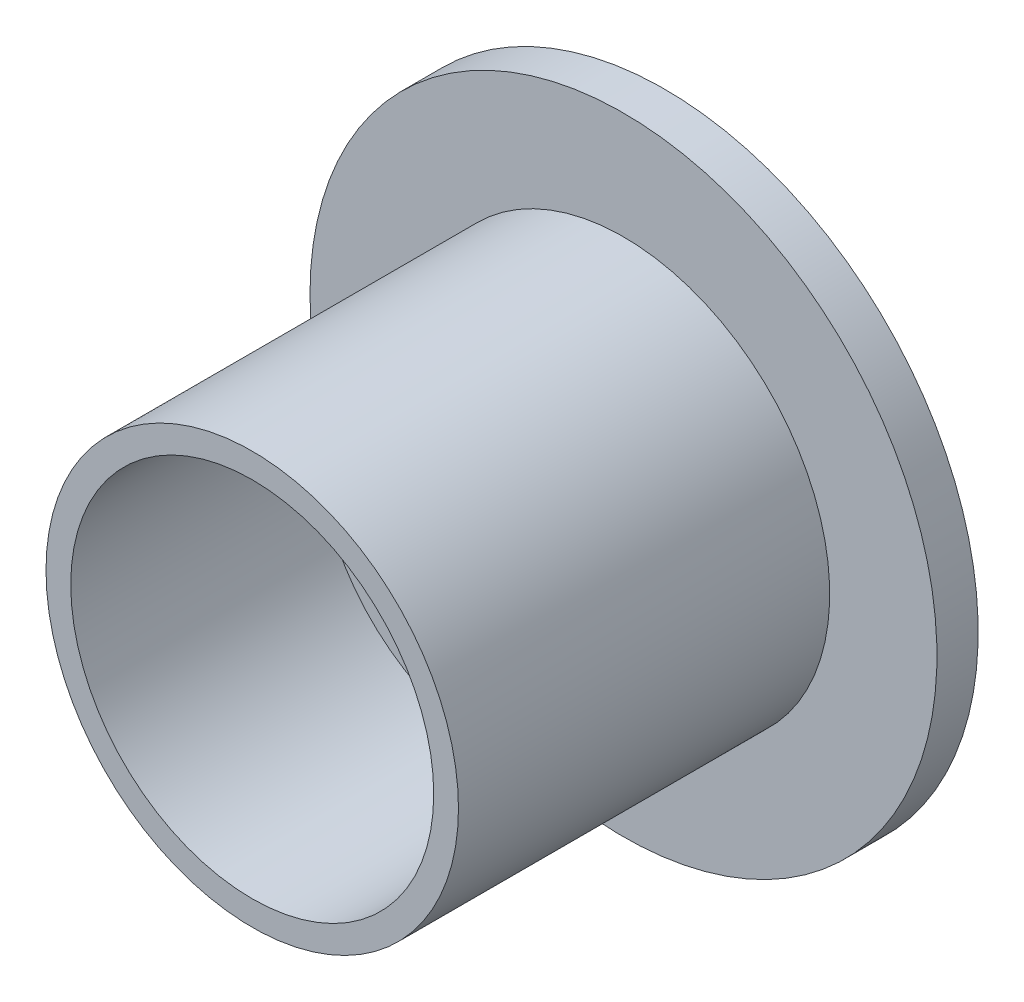
from build123d import *

# Parameters (mm, degrees)
SKETCH1_R           = 25
BOSS_EXTRUDE1_DEPTH = 50
SKETCH4_W           = 5
SKETCH4_H           = 13
SKETCH2_R           = 22
CUT_EXTRUDE1_DEPTH  = 74.402997214
CUT_EXTRUDE1_DRAFT  = -5
SKETCH3_R           = 22
CUT_EXTRUDE2_DEPTH  = 30


with BuildPart() as part:
    # Sketch1 → Boss-Extrude1 (new body)
    with BuildSketch(Plane.XY):
        Circle(SKETCH1_R)
    extrude(amount=BOSS_EXTRUDE1_DEPTH)

    # Sketch4 → Revolve1 (revolve)
    with BuildSketch(Plane(origin=(0, 0, 0), x_dir=(0, 0, -1), z_dir=(1, 0, 0)), mode=Mode.PRIVATE) as revolve1_sk:
        with Locations((-2.5, 31.5)):
            Rectangle(SKETCH4_W, SKETCH4_H)
    revolve(revolve1_sk.sketch.rotate(Axis((0, 0, -2.5), (0, 0, 1)), 90), axis=Axis((0, 0, -2.5), (0, 0, 1)))


with BuildPart() as cut_extrude1_tool:
    # Sketch2 → Cut-Extrude1 (with draft: the straight prism first)
    with BuildSketch(Plane(origin=(0, 0, 0), x_dir=(-1, 0, 0), z_dir=(0, 0, -1))):
        Circle(SKETCH2_R)
    extrude(amount=-CUT_EXTRUDE1_DEPTH)
    # Cut-Extrude1: the draft: its side faces are tilted about the plane it starts from
    cut_extrude1_sides = [cut_extrude1_tool.faces().sort_by_distance(p)[0] for p in [
        (22, 0, 37.201498607),
    ]]
    draft(cut_extrude1_sides, Plane(origin=(0, 0, 0), x_dir=(-1, 0, 0), z_dir=(0, 0, -1)), CUT_EXTRUDE1_DRAFT)


with BuildPart() as part_1:
    add(part.part)

    # Cut-Extrude1: cut by cut_extrude1_tool
    add(cut_extrude1_tool.part, mode=Mode.SUBTRACT)

    # Sketch3 → Cut-Extrude2 (cut)
    with BuildSketch(Plane.XY.offset(50)):
        Circle(SKETCH3_R)
    extrude(amount=-CUT_EXTRUDE2_DEPTH, mode=Mode.SUBTRACT)


solid = part_1.part
